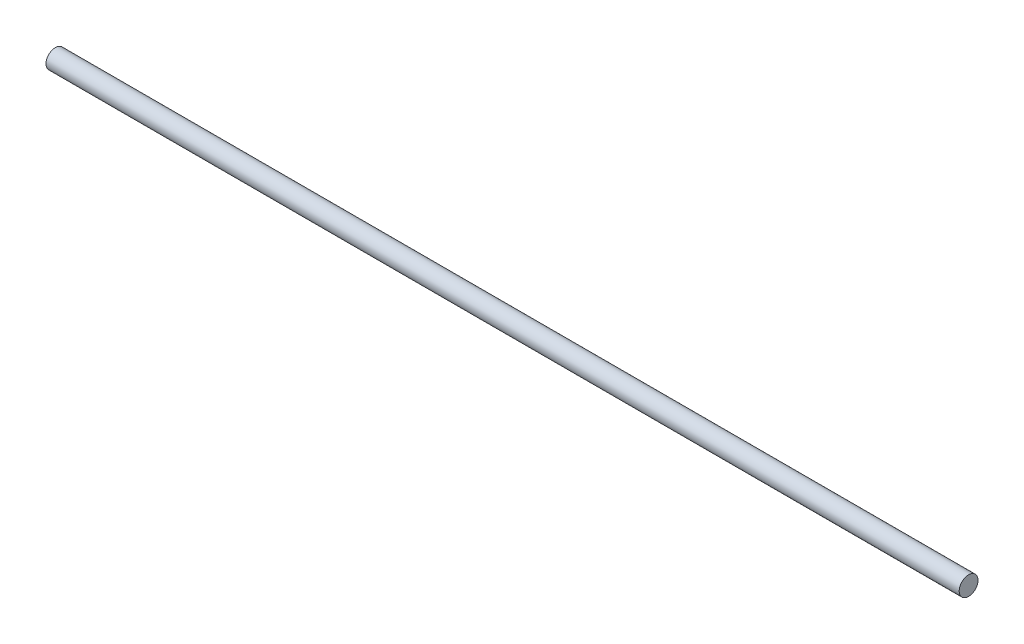
from build123d import *

# Parameters (mm, degrees)
SKETCH1_W = 218.5
SKETCH1_H = 2.25


with BuildPart() as part:
    # Sketch1 → Revolve1 (revolve)
    with BuildSketch(Plane.XY, mode=Mode.PRIVATE) as revolve1_sk:
        with Locations((109.25, 1.125)):
            Rectangle(SKETCH1_W, SKETCH1_H)
    revolve(revolve1_sk.sketch.rotate(Axis((0, 0, 0), (-1, 0, 0)), 90), axis=Axis((0, 0, 0), (-1, 0, 0)))


solid = part.part
